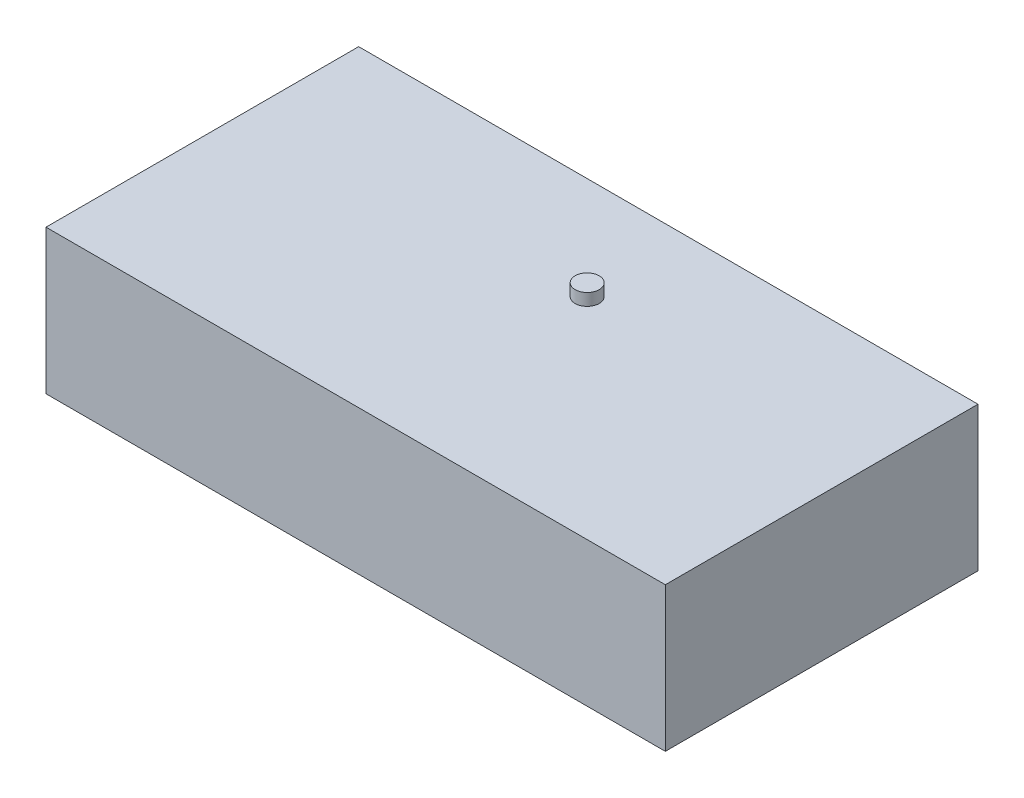
from build123d import *

# Parameters (mm, degrees)
SKETCH1_W           = 51.5
SKETCH1_H           = 26
BOSS_EXTRUDE1_DEPTH = 12
SKETCH2_R           = 1
BOSS_EXTRUDE2_DEPTH = 1


with BuildPart() as part:
    # Sketch1 → Boss-Extrude1 (new body)
    with BuildSketch(Plane(origin=(0, 0, 0), x_dir=(1, 0, 0), z_dir=(0, 1, 0))):
        with Locations((25.75, 13)):
            Rectangle(SKETCH1_W, SKETCH1_H)
    extrude(amount=BOSS_EXTRUDE1_DEPTH)

    # Sketch2 → Boss-Extrude2 (add)
    with BuildSketch(Plane(origin=(0, 12, 0), x_dir=(1, 0, 0), z_dir=(0, 1, 0))):
        with Locations(Location((27.5, 17.5, 0), (0, 0, 90))):
            Circle(SKETCH2_R)
    extrude(amount=BOSS_EXTRUDE2_DEPTH)


solid = part.part
